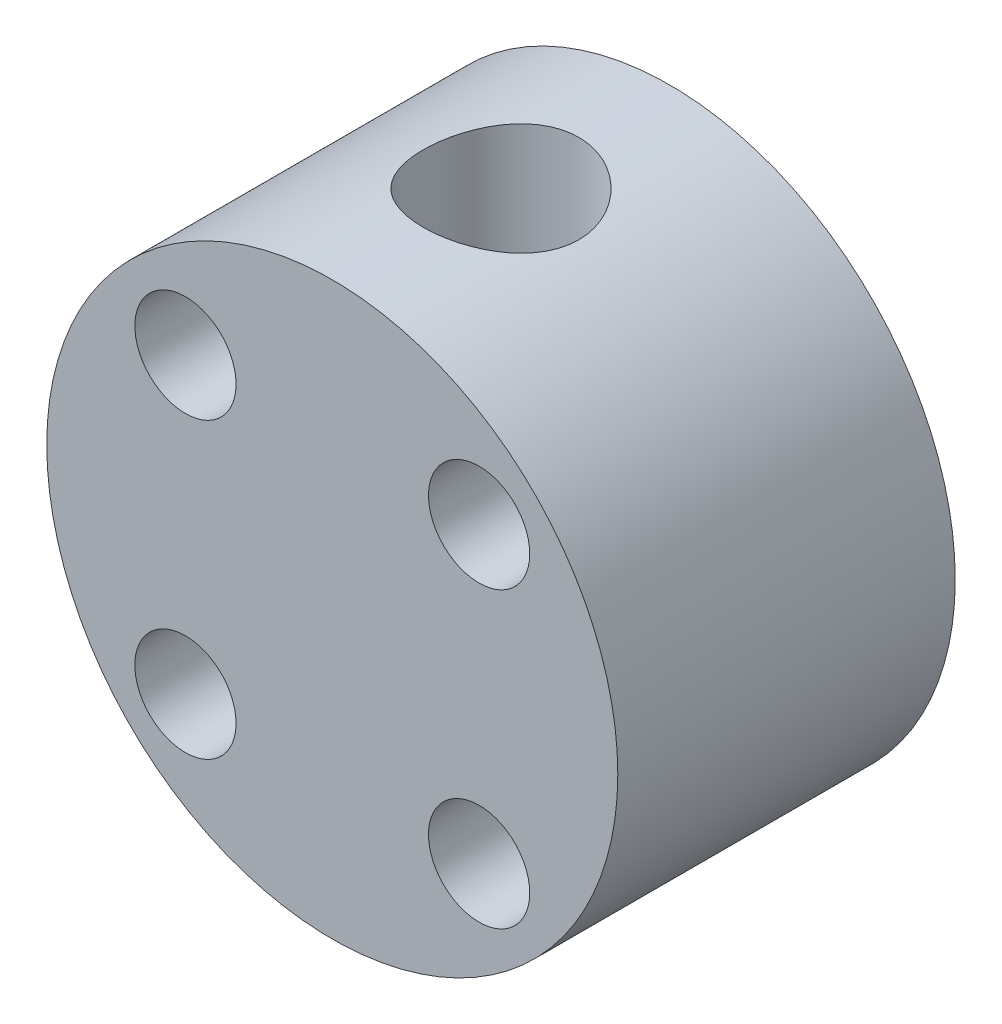
from build123d import *

# Parameters (mm, degrees)
SKETCH1_R               = 11
BOSS_EXTRUDE1_DEPTH     = 6.5
CUT_EXTRUDE1_DEPTH      = 17.8597153
CUT_EXTRUDE1_DEPTH_BACK = 17.8597153
SKETCH2_R               = 3
M3_CLEARANCE_HOLE1_D    = 3.9


with BuildPart() as part:
    # Sketch1 → Boss-Extrude1 (new, symmetric)
    with BuildSketch(Plane.XY):
        with Locations(Location((0, 0, 0), (0, 0, 180))):
            Circle(SKETCH1_R)
    extrude(amount=BOSS_EXTRUDE1_DEPTH, both=True)

    # Sketch2 → Cut-Extrude1 (cut, two sides: drawn at the far end of the back side and taken through both)
    with BuildSketch(Plane(origin=(0, 0, 0), x_dir=(1, 0, 0), z_dir=(0, 1, 0)).offset(-CUT_EXTRUDE1_DEPTH_BACK)):
        with Locations(Location((0, 0, 0), (0, 0, 270))):
            Circle(SKETCH2_R)
    extrude(amount=CUT_EXTRUDE1_DEPTH + CUT_EXTRUDE1_DEPTH_BACK, mode=Mode.SUBTRACT)

    # M3 Clearance Hole1 (through all)
    with Locations(Plane.XY.offset(6.5)):
        with Locations((5.656854249, 5.656854249), (-5.656854249, -5.656854249), (-5.656854249, 5.656854249), (5.656854249, -5.656854249)):
            Hole(M3_CLEARANCE_HOLE1_D / 2)


solid = part.part
